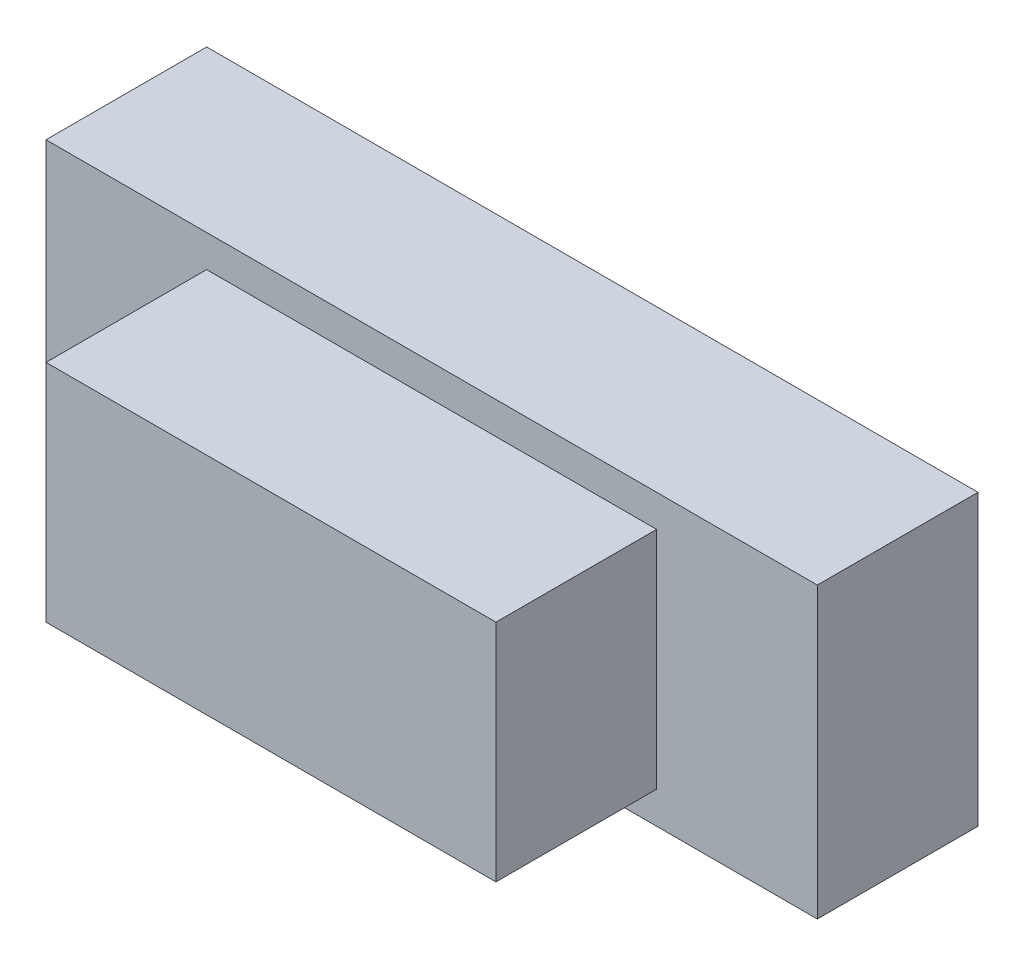
from build123d import *

# Parameters (mm, degrees)
SKETCH1_W           = 60.96
SKETCH1_H           = 22.86
BOSS_EXTRUDE1_DEPTH = 12.7
SKETCH2_W           = 35.56
SKETCH2_H           = 17.78
TEENSY_DEPTH        = 12.7


with BuildPart() as part:
    # Sketch1 → Boss-Extrude1 (new body)
    with BuildSketch(Plane.XY):
        Rectangle(SKETCH1_W, SKETCH1_H)
    extrude(amount=BOSS_EXTRUDE1_DEPTH)

    # Sketch2 → Teensy (add)
    with BuildSketch(Plane.XY.offset(12.7)):
        Rectangle(SKETCH2_W, SKETCH2_H)
    extrude(amount=TEENSY_DEPTH)


solid = part.part
